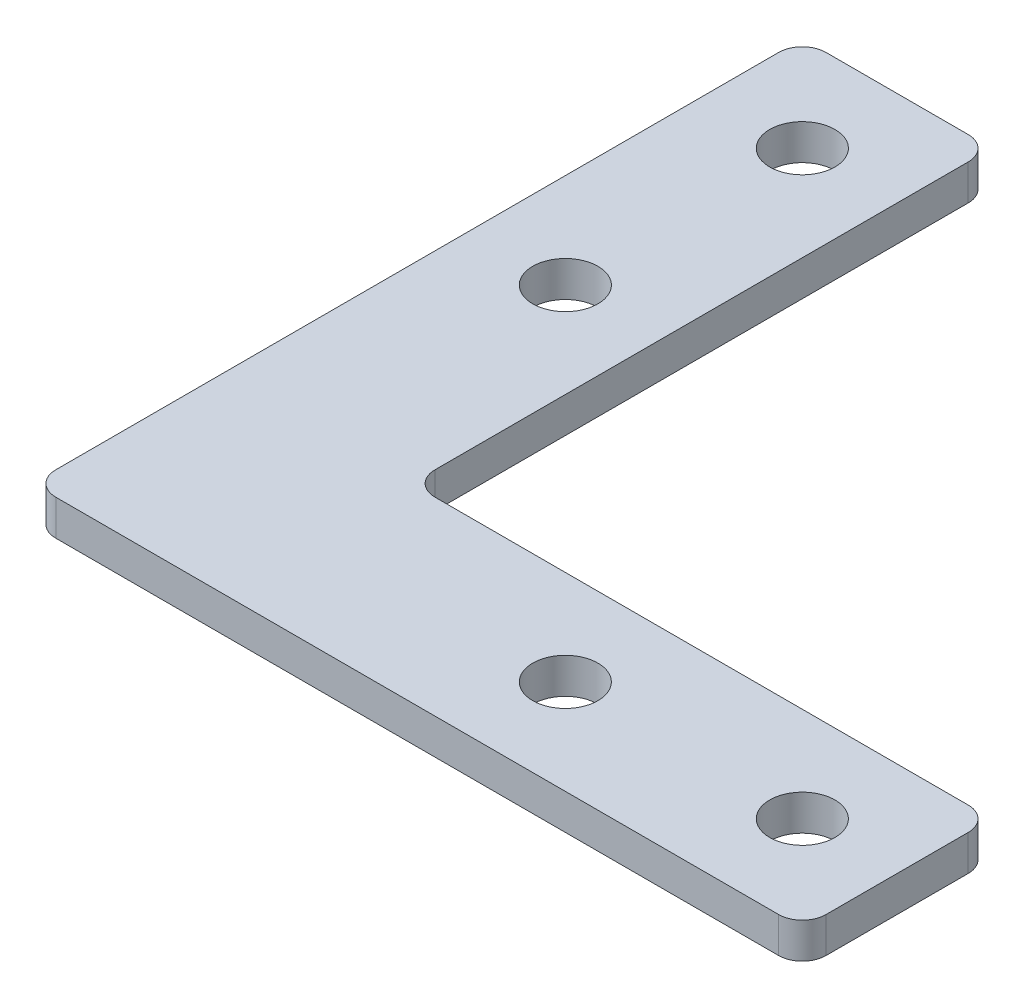
from build123d import *

# Parameters (mm, degrees)
SKETCH_1_R      = 2.75
EXTRUDE_1_DEPTH = 3


with BuildPart() as part:
    # 草图1 → 凸台-拉伸1 (new body)
    with BuildSketch(Plane(origin=(0, 0, 0), x_dir=(1, 0, 0), z_dir=(0, 1, 0))):
        with BuildLine():
            Line((-36.318637667, 40.422025804), (-36.318637667, -20.577974196))
            ThreePointArc((-36.318637667, -20.577974196), (-35.73285123, -21.992187758), (-34.318637667, -22.577974196))
            Line((-34.318637667, -22.577974196), (26.681362333, -22.577974196))
            ThreePointArc((26.681362333, -22.577974196), (28.095575895, -21.992187758), (28.681362333, -20.577974196))
            Line((28.681362333, -20.577974196), (28.681362333, -8.577974196))
            ThreePointArc((28.681362333, -8.577974196), (28.095575895, -7.163760633), (26.681362333, -6.577974196))
            Line((26.681362333, -6.577974196), (-18.318637667, -6.577974196))
            ThreePointArc((-18.318637667, -6.577974196), (-19.73285123, -5.992187758), (-20.318637667, -4.577974196))
            Line((-20.318637667, -4.577974196), (-20.318637667, 40.422025804))
            ThreePointArc((-20.318637667, 40.422025804), (-20.904424105, 41.836239367), (-22.318637667, 42.422025804))
            Line((-22.318637667, 42.422025804), (-34.318637667, 42.422025804))
            ThreePointArc((-34.318637667, 42.422025804), (-35.73285123, 41.836239367), (-36.318637667, 40.422025804))
        make_face()
        with Locations(Location((20.681362333, -14.577974196, 0), (0, 0, 270))):
            Circle(SKETCH_1_R, mode=Mode.SUBTRACT)
        with Locations(Location((0.681362333, -14.577974196, 0), (0, 0, 270))):
            Circle(SKETCH_1_R, mode=Mode.SUBTRACT)
        with Locations(Location((-28.318637667, 34.422025804, 0), (0, 0, 90))):
            Circle(SKETCH_1_R, mode=Mode.SUBTRACT)
        with Locations(Location((-28.318637667, 14.422025804, 0), (0, 0, 90))):
            Circle(SKETCH_1_R, mode=Mode.SUBTRACT)
    extrude(amount=EXTRUDE_1_DEPTH)


solid = part.part
